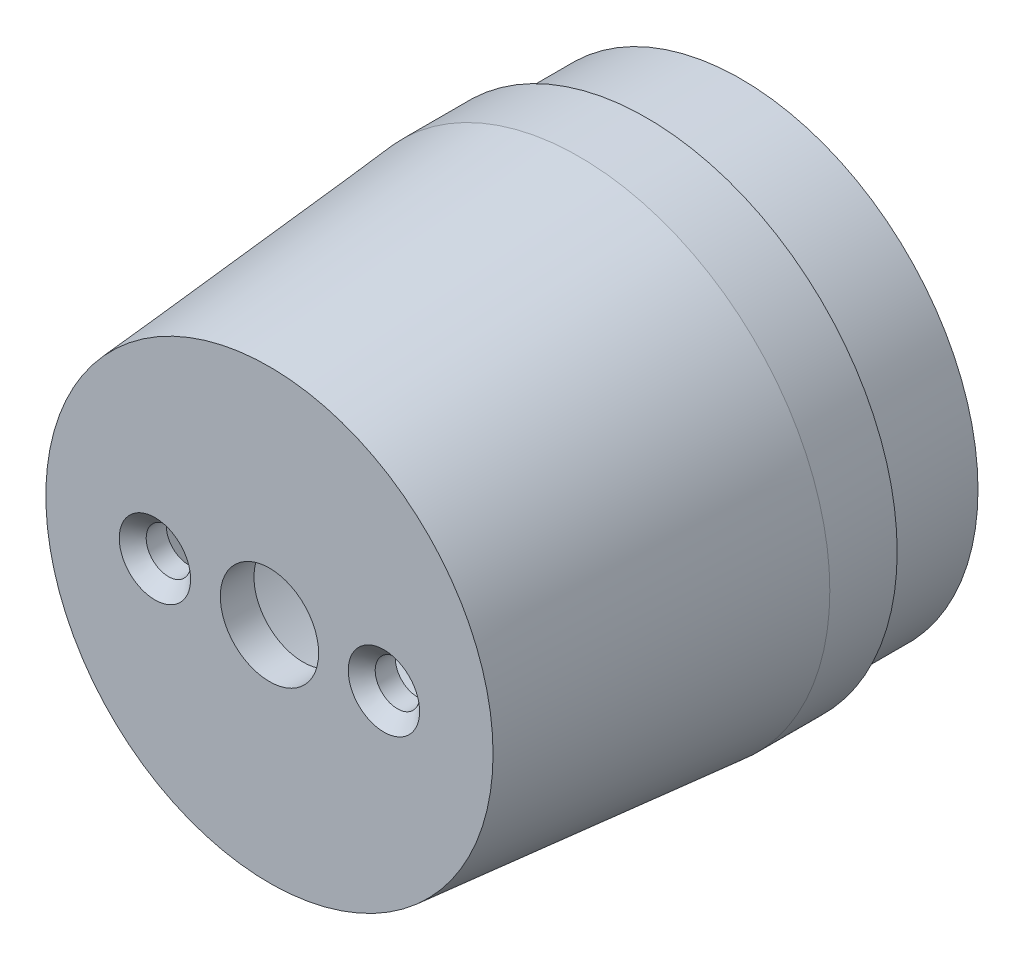
from build123d import *

# Parameters (mm, degrees)
SKETCH2_R              = 1.65
CUT_EXTRUDE_3_6_DEPTH  = 4.5
CHAMFER_1_SIZE         = 1
SKETCH3_R              = 1
CUT_EXTRUDE_3_20_DEPTH = 25


with BuildPart() as part:
    # Sketch1 → Revolve 696 (revolve)
    with BuildSketch(Plane(origin=(0, 0, 0), x_dir=(0, 0, -1), z_dir=(1, 0, 0)), mode=Mode.PRIVATE) as revolve_696_sk:
        Polygon((-7.5, 12.7), (25, 12.7), (25, 17.6), (18, 17.6), (18, 18.6), (-10, 18.6), (-10, 3.65), (-7.5, 3.65), align=None)
    revolve(revolve_696_sk.sketch.rotate(Axis((0, 0, 0), (0, 0, -1)), 90), axis=Axis((0, 0, 0), (0, 0, -1)))

    # Sketch2 → Крепление к двигателю (винт с потайной головкой М3х6) (cut)
    with BuildSketch(Plane.XY.offset(10)):
        with Locations((8.5, 0)):
            Circle(SKETCH2_R)
        with Locations((-8.5, 0)):
            Circle(SKETCH2_R)
    extrude(amount=-CUT_EXTRUDE_3_6_DEPTH, mode=Mode.SUBTRACT)

    # Фаска 1
    chamfer_1_edges = [part.edges().sort_by_distance(p)[0] for p in [
        (6.85, 0, 10),
        (-10.15, 0, 10),
    ]]
    chamfer(chamfer_1_edges, length=CHAMFER_1_SIZE)

    # Sketch3 → Отверстие под саморез М3х20 (cut)
    with BuildSketch(Plane(origin=(0, 0, -25), x_dir=(-1, 0, 0), z_dir=(0, 0, -1))):
        with Locations((-10.606601718, 10.606601718)):
            Circle(SKETCH3_R)
        with Locations((10.606601718, 10.606601718)):
            Circle(SKETCH3_R)
        with Locations((10.606601718, -10.606601718)):
            Circle(SKETCH3_R)
        with Locations((-10.606601718, -10.606601718)):
            Circle(SKETCH3_R)
    extrude(amount=-CUT_EXTRUDE_3_20_DEPTH, mode=Mode.SUBTRACT)

    # Эскиз2 → Cut-Revolve 1559 (revolve, cut)
    with BuildSketch(Plane(origin=(0, 0, 0), x_dir=(0, 0, -1), z_dir=(1, 0, 0)), mode=Mode.PRIVATE) as cut_revolve_1559_sk:
        Polygon((-10, 18.6), (-10, 16.6), (13, 18.6), align=None)
    revolve(cut_revolve_1559_sk.sketch.rotate(Axis((0, 0, 10), (0, 0, -1)), 90), axis=Axis((0, 0, 10), (0, 0, -1)), mode=Mode.SUBTRACT)


solid = part.part
